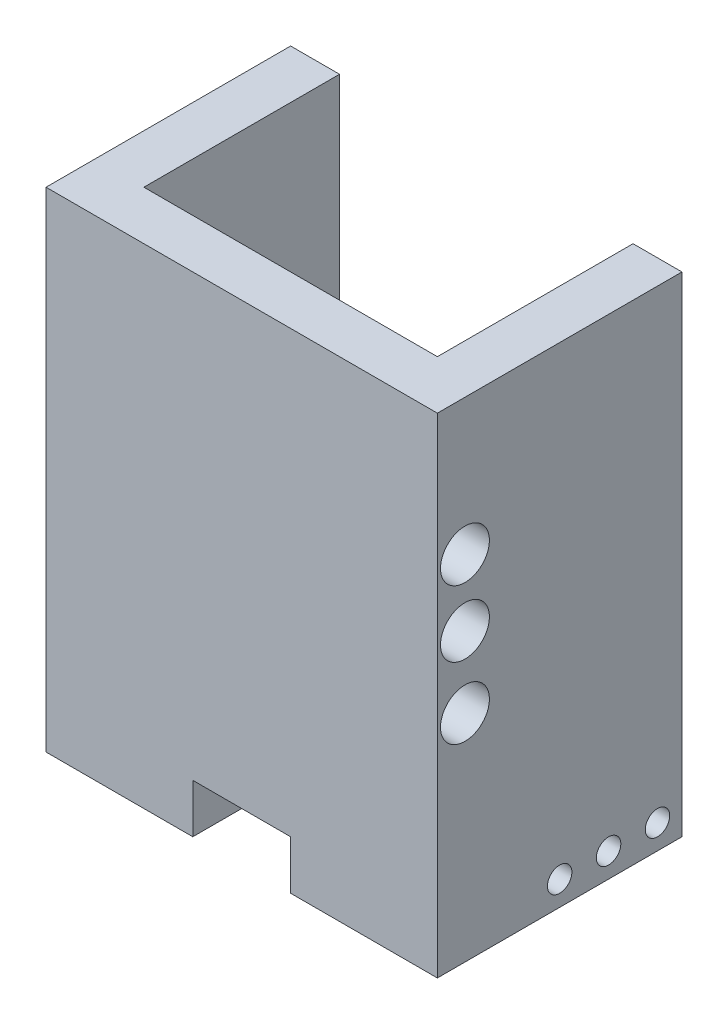
from build123d import *

# Parameters (mm, degrees)
BOSS_EXTRUDE1_DEPTH = 63.5
CUT_EXTRUDE1_DEPTH  = 151.804144505
SKETCH3_R           = 6.35
CUT_EXTRUDE2_DEPTH  = 175.596133978
SKETCH4_R           = 3.175
CUT_EXTRUDE3_DEPTH  = 175.596133978


with BuildPart() as part:
    # Sketch1 → Boss-Extrude1 (new body)
    with BuildSketch(Plane.XY):
        Polygon((12.7, -127), (50.8, -127), (50.8, 0), (-50.8, 0), (-50.8, -127), (-12.7, -127), (-12.7, -114.3), (12.7, -114.3), align=None)
    extrude(amount=-BOSS_EXTRUDE1_DEPTH)

    # Sketch2 → Cut-Extrude1 (cut, through all)
    with BuildSketch(Plane(origin=(0, 0, 0), x_dir=(1, 0, 0), z_dir=(0, 1, 0))):
        Polygon((-38.1, 50.8), (-38.1, 63.5), (38.1, 63.5), (38.1, 50.8), (38.1, 12.7), (-38.1, 12.7), align=None)
    extrude(amount=-CUT_EXTRUDE1_DEPTH, mode=Mode.SUBTRACT)

    # Sketch3 → Cut-Extrude2 (cut, through all)
    with BuildSketch(Plane.ZY.offset(50.8)):
        with Locations((-7.159845265, -35.322751873)):
            Circle(SKETCH3_R)
        with Locations((-7.159845265, -52.530231645)):
            Circle(SKETCH3_R)
        with Locations((-7.159845265, -71.0282724)):
            Circle(SKETCH3_R)
    extrude(amount=-CUT_EXTRUDE2_DEPTH, mode=Mode.SUBTRACT)

    # Sketch4 → Cut-Extrude3 (cut, through all)
    with BuildSketch(Plane.ZY.offset(50.8)):
        with Locations((-57.15, -120.65)):
            Circle(SKETCH4_R)
        with Locations((-44.45, -120.65)):
            Circle(SKETCH4_R)
        with Locations((-31.75, -120.65)):
            Circle(SKETCH4_R)
    extrude(amount=-CUT_EXTRUDE3_DEPTH, mode=Mode.SUBTRACT)


solid = part.part
